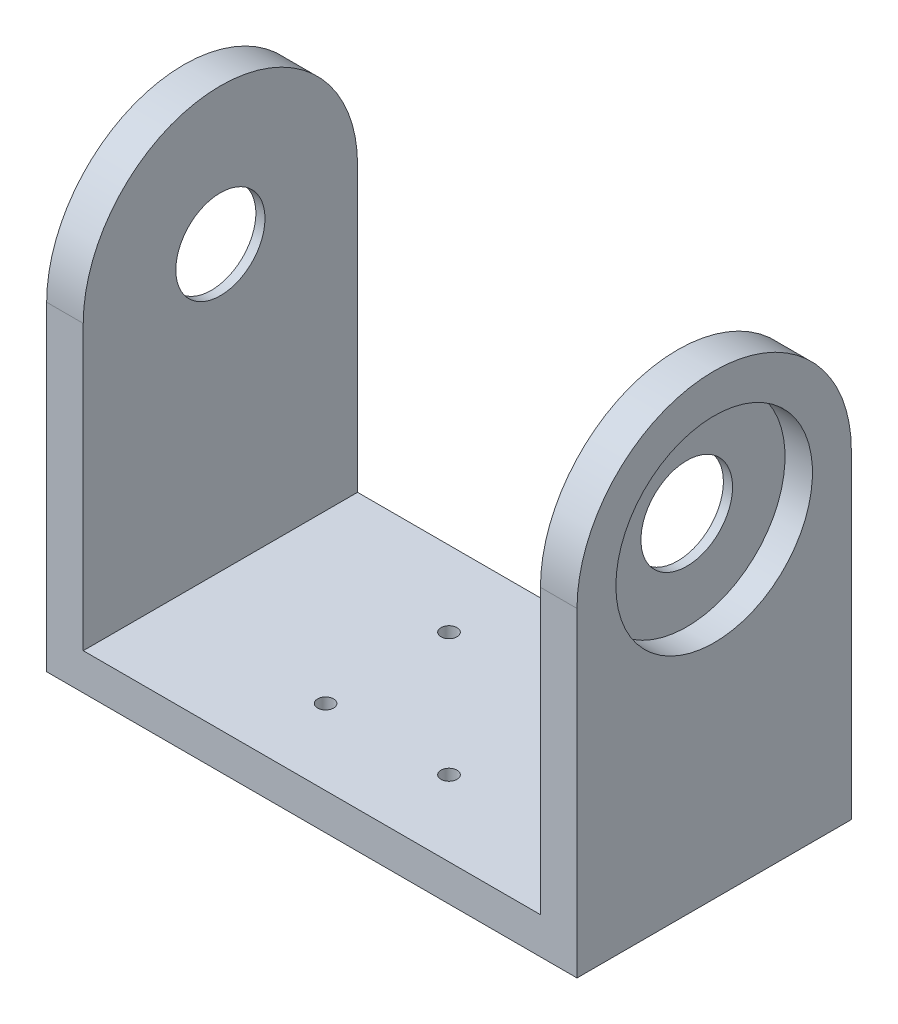
from build123d import *

# Parameters (mm, degrees)
SKETCH2_W           = 50
SKETCH2_H           = 30
BOSS_EXTRUDE1_DEPTH = 4
SKETCH3_R           = 10.75
BOSS_EXTRUDE2_DEPTH = 4
SKETCH4_R           = 10.75
SKETCH4_R_2         = 6.25
BOSS_EXTRUDE3_DEPTH = 1
SKETCH5_R           = 6.25
SKETCH5_R_2         = 5.01
BOSS_EXTRUDE4_DEPTH = 1
BOSS_EXTRUDE5_START = -1
SKETCH6_R           = 6.25
SKETCH6_R_2         = 4.875
BOSS_EXTRUDE5_DEPTH = 1
SKETCH8_R           = 0.875
CUT_EXTRUDE1_DEPTH  = 10


with BuildPart() as part:
    # Sketch2 → Boss-Extrude1 (new body)
    with BuildSketch(Plane(origin=(0, 0, 0), x_dir=(1, 0, 0), z_dir=(0, 1, 0))):
        Rectangle(SKETCH2_W, SKETCH2_H)
    extrude(amount=BOSS_EXTRUDE1_DEPTH)

    # Sketch3 → Boss-Extrude2 (add)
    with BuildSketch(Plane.ZY.offset(25)):
        with BuildLine():
            Line((-15, 0), (-15, 35))
            ThreePointArc((-15, 35), (0, 50), (15, 35))
            Line((15, 35), (15, 0))
            Line((15, 0), (-15, 0))
        make_face()
        with Locations((0, 35)):
            Circle(SKETCH3_R, mode=Mode.SUBTRACT)
    boss_extrude2 = extrude(amount=BOSS_EXTRUDE2_DEPTH)

    # Mirror1: Boss-Extrude2 across plane
    add(boss_extrude2.mirror(Plane(origin=(0, 0, 0), x_dir=(0, 0, 1), z_dir=(1, 0, 0))))

    # Sketch4 → Boss-Extrude3 (add)
    with BuildSketch(Plane(origin=(-25, 0, 0), x_dir=(0, 0, -1), z_dir=(1, 0, 0))):
        with Locations((0, 35)):
            Circle(SKETCH4_R)
        with Locations((0, 35)):
            Circle(SKETCH4_R_2, mode=Mode.SUBTRACT)
    boss_extrude3 = extrude(amount=-BOSS_EXTRUDE3_DEPTH)

    # Mirror2: Boss-Extrude3 across plane
    add(boss_extrude3.mirror(Plane(origin=(0, 0, 0), x_dir=(0, 0, 1), z_dir=(1, 0, 0))))

    # Sketch5 → Boss-Extrude4 (add)
    with BuildSketch(Plane(origin=(26, 0, 0), x_dir=(0, 0, -1), z_dir=(1, 0, 0))):
        with Locations((0, 35)):
            Circle(SKETCH5_R)
        with Locations((0, 35)):
            Circle(SKETCH5_R_2, mode=Mode.SUBTRACT)
    extrude(amount=-BOSS_EXTRUDE4_DEPTH)

    # Sketch6 → Boss-Extrude5 (add)
    with BuildSketch(Plane.ZY.offset(26).offset(BOSS_EXTRUDE5_START)):
        with Locations((0, 35)):
            Circle(SKETCH6_R)
        with Locations((0, 35)):
            Circle(SKETCH6_R_2, mode=Mode.SUBTRACT)
    extrude(amount=BOSS_EXTRUDE5_DEPTH)

    # Sketch8 → Cut-Extrude1 (cut)
    with BuildSketch(Plane.XZ):
        with Locations(Location((-6.75, 6.75, 0), (0, 0, 270))):
            Circle(SKETCH8_R)
        with Locations(Location((6.75, 6.75, 0), (0, 0, 270))):
            Circle(SKETCH8_R)
        with Locations(Location((6.75, -6.75, 0), (0, 0, 270))):
            Circle(SKETCH8_R)
        with Locations(Location((-6.75, -6.75, 0), (0, 0, 270))):
            Circle(SKETCH8_R)
    extrude(amount=-CUT_EXTRUDE1_DEPTH, mode=Mode.SUBTRACT)


solid = part.part
